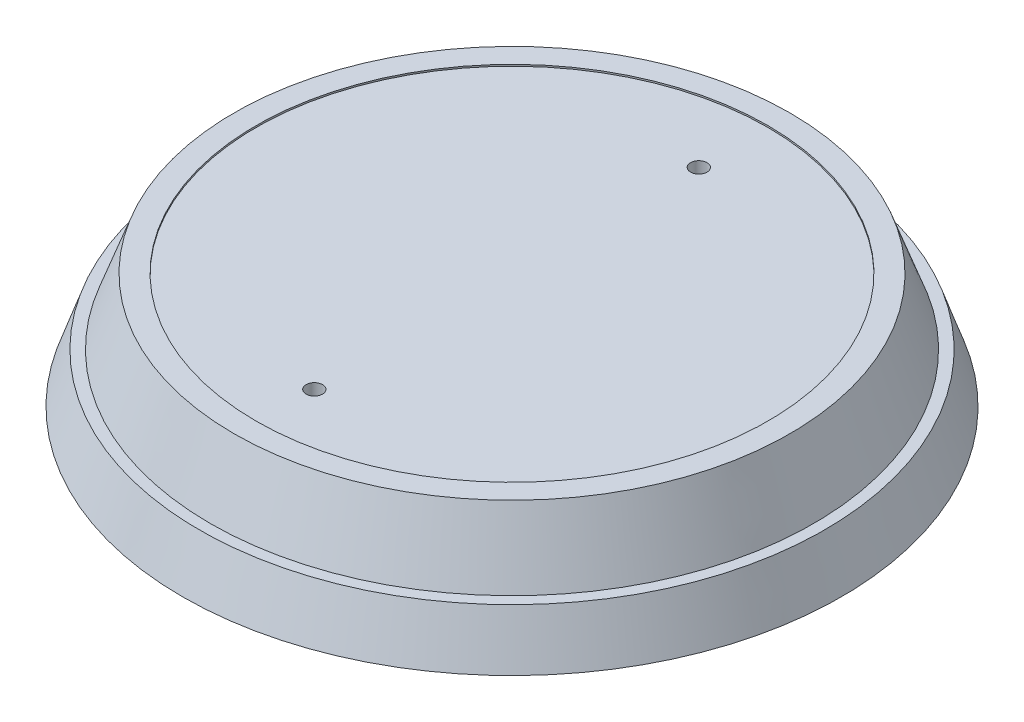
from build123d import *

# Parameters (mm, degrees)
SKETCH2_R           = 23.5
BOSS_EXTRUDE1_DEPTH = 0.5
SKETCH3_R           = 0.75
CUT_EXTRUDE1_DEPTH  = 5


with BuildPart() as part:
    # Sketch1 → Revolve1 (revolve)
    with BuildSketch(Plane.XY, mode=Mode.PRIVATE) as revolve1_sk:
        Polygon((0, 0), (0, 4.850885244), (23.3, 4.850885244), (23.3, 5.500885244), (25.3, 5.500885244), (27.458615933, -0.499114756), (28.458615933, -0.499114756), (30, -5), (15, -5), (15, 0), align=None)
    revolve(revolve1_sk.sketch.rotate(Axis((0, 0, 0), (0, 1, 0)), 90), axis=Axis((0, 0, 0), (0, 1, 0)))

    # Sketch2 → Boss-Extrude1 (add)
    with BuildSketch(Plane(origin=(0, 4.850885244, 0), x_dir=(1, 0, 0), z_dir=(0, 1, 0))):
        Circle(SKETCH2_R)
    extrude(amount=BOSS_EXTRUDE1_DEPTH)

    # Sketch3 → Cut-Extrude1 (cut)
    with BuildSketch(Plane(origin=(0, 5.350885244, 0), x_dir=(1, 0, 0), z_dir=(0, 1, 0))):
        with Locations(Location((0, 17.004734632, 0), (0, 0, 270))):
            Circle(SKETCH3_R)
        with Locations(Location((0, -17.995265368, 0), (0, 0, 270))):
            Circle(SKETCH3_R)
    extrude(amount=-CUT_EXTRUDE1_DEPTH, mode=Mode.SUBTRACT)


solid = part.part
